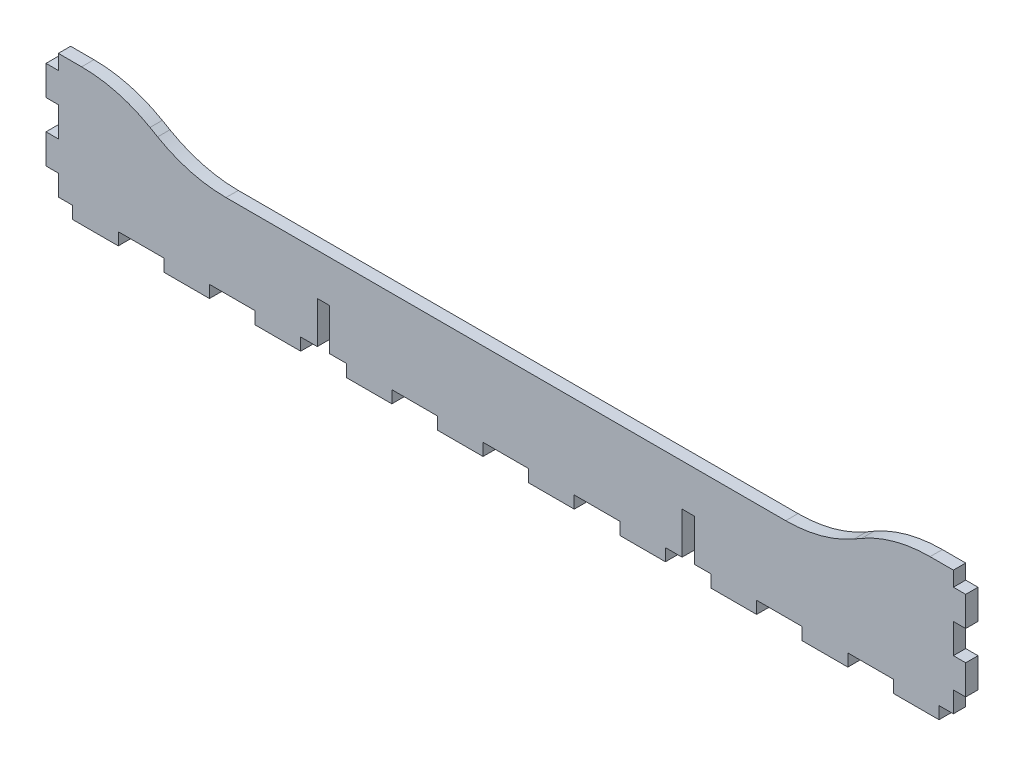
from build123d import *

# Parameters (mm, degrees)
ESQUISSE1_W                = 98.15
ESQUISSE1_H                = 27.3
BOSS_EXTRU_1_DEPTH         = 2.7
ESQUISSE2_W                = 10
ESQUISSE2_H                = 2.7
BOSS_EXTRU_2_DEPTH         = 2.7
R_P_TITION_LIN_AIRE1_COUNT = 5
R_P_TITION_LIN_AIRE1_PITCH = 20
ESQUISSE3_W                = 2.7
ESQUISSE3_H                = 6.5
BOSS_EXTRU_3_DEPTH         = 2.7
R_P_TITION_LIN_AIRE2_COUNT = 2
R_P_TITION_LIN_AIRE2_PITCH = 13
ENL_V_MAT_EXTRU_1_DEPTH    = 2.7
CONG_1_R                   = 30
ESQUISSE5_W                = 2.7
ESQUISSE5_H                = 9.15
ENL_V_MAT_EXTRU_2_DEPTH    = 2.7


with BuildPart() as part:
    # Esquisse1 → Boss.-Extru.1 (new body)
    with BuildSketch(Plane.XY):
        with Locations((49.075, -13.65)):
            Rectangle(ESQUISSE1_W, ESQUISSE1_H)
    extrude(amount=BOSS_EXTRU_1_DEPTH)

    # Esquisse2 → Boss.-Extru.2 (add)
    with BuildSketch(Plane.XY):
        with Locations((10, -28.65)):
            Rectangle(ESQUISSE2_W, ESQUISSE2_H)
    boss_extru_2 = extrude(amount=BOSS_EXTRU_2_DEPTH)

    # Répétition linéaire1: Boss.-Extru.2 ×5
    with Locations(*[(i * R_P_TITION_LIN_AIRE1_PITCH, 0, 0) for i in range(1, R_P_TITION_LIN_AIRE1_COUNT)]):
        add(boss_extru_2)

    # Esquisse3 → Boss.-Extru.3 (add)
    with BuildSketch(Plane.XY):
        with Locations((99.5, -6.5)):
            Rectangle(ESQUISSE3_W, ESQUISSE3_H)
    boss_extru_3 = extrude(amount=BOSS_EXTRU_3_DEPTH)

    # Répétition linéaire2: Boss.-Extru.3 ×2
    with Locations(*[(0, -i * R_P_TITION_LIN_AIRE2_PITCH, 0) for i in range(1, R_P_TITION_LIN_AIRE2_COUNT)]):
        add(boss_extru_3)

    # Esquisse4 → Enlèv. mat.-Extru.1 (cut)
    with BuildSketch(Plane.XY):
        Polygon((0, -9), (69.411542732, -9), (85, 0), (0, 0), align=None)
    extrude(amount=ENL_V_MAT_EXTRU_1_DEPTH, mode=Mode.SUBTRACT)

    # Congé1
    cong_1_edges = [part.edges().sort_by_distance(p)[0] for p in [
        (69.411542732, -9, 1.35),
        (85, 0, 1.35),
    ]]
    fillet(cong_1_edges, radius=CONG_1_R)

    # Symétrie1: part across plane


with BuildPart() as part_1:
    add(part.part)
    add(part.part.mirror(Plane(origin=(0, 0, 0), x_dir=(0, 0, 1), z_dir=(1, 0, 0))))

    # Esquisse5 → Enlèv. mat.-Extru.2 (cut)
    with BuildSketch(Plane.XY):
        with Locations((40, -22.725)):
            Rectangle(ESQUISSE5_W, ESQUISSE5_H)
    enl_v_mat_extru_2 = extrude(amount=ENL_V_MAT_EXTRU_2_DEPTH, mode=Mode.SUBTRACT)

    # Symétrie2: Enlèv. mat.-Extru.2 across plane
    add(enl_v_mat_extru_2.mirror(Plane(origin=(0, 0, 0), x_dir=(0, 0, 1), z_dir=(1, 0, 0))), mode=Mode.SUBTRACT)


solid = part_1.part
